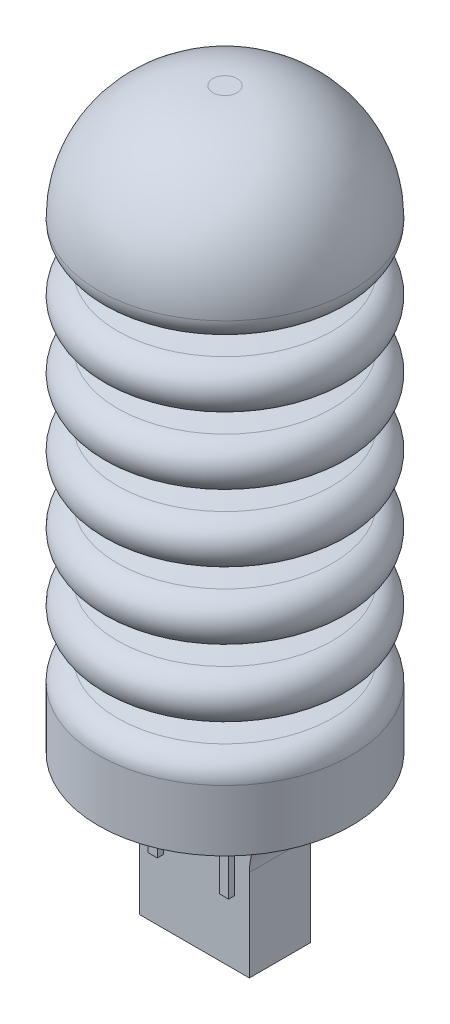
from build123d import *

# Parameters (mm, degrees)
BOSS_EXTRUDE2_REACH = 93.868
SKETCH2_R           = 20.750019809
BOSS_EXTRUDE1_DEPTH = 10
SKETCH5_R           = 2.05
CUT_EXTRUDE1_DEPTH  = 10
BOSS_EXTRUDE3_START = 25
SKETCH6_W           = 18
SKETCH6_H           = 10
SKETCH6_R           = 2.05
BOSS_EXTRUDE3_DEPTH = 25
FILLET1_R           = 10
SKETCH7_W           = 1.5
SKETCH7_H           = 14.5
BOSS_EXTRUDE4_DEPTH = 1


with BuildPart() as part:
    # Sketch1 → Revolve2 (revolve)
    with BuildSketch(Plane(origin=(0, 0, 0), x_dir=(0, 0, -1), z_dir=(1, 0, 0))):
        with BuildLine():
            Line((-9.616751909, 62.551085638), (-3.251663234, 61.489785283))
            ThreePointArc((-3.251663234, 61.489785283), (-2.625013615, 60.749995786), (-3.251668322, 60.010210599))
            Line((-3.251668322, 60.010210599), (-9.616767827, 58.948953436))
            ThreePointArc((-9.616767827, 58.948953436), (-12.75001785, 55.250030043), (-9.616764802, 51.551086511))
            Line((-9.616764802, 51.551086511), (-3.251664068, 50.489785422))
            ThreePointArc((-3.251664068, 50.489785422), (-2.625013615, 49.749996092), (-3.251668552, 49.010210561))
            Line((-3.251668552, 49.010210561), (-9.616745174, 47.948959247))
            ThreePointArc((-9.616745174, 47.948959247), (-12.750019856, 44.250032756), (-9.616769893, 40.551085326))
            Line((-9.616769893, 40.551085326), (-3.251664068, 39.489785422))
            ThreePointArc((-3.251664068, 39.489785422), (-2.625013615, 38.749996092), (-3.251668552, 38.010210561))
            Line((-3.251668552, 38.010210561), (-9.616745174, 36.948959247))
            ThreePointArc((-9.616745174, 36.948959247), (-12.750019856, 33.250032756), (-9.616769893, 29.551085326))
            Line((-9.616769893, 29.551085326), (-3.251663378, 28.489785307))
            ThreePointArc((-3.251663378, 28.489785307), (-2.625013615, 27.749995743), (-3.251668552, 27.010210561))
            Line((-3.251668552, 27.010210561), (-9.616745174, 25.948959247))
            ThreePointArc((-9.616745174, 25.948959247), (-12.750019856, 22.250032756), (-9.616769893, 18.551085326))
            Line((-9.616769893, 18.551085326), (-3.251663378, 17.489785307))
            ThreePointArc((-3.251663378, 17.489785307), (-2.625013615, 16.749995859), (-3.251668322, 16.010210599))
            Line((-3.251668322, 16.010210599), (-9.616745994, 14.948957076))
            ThreePointArc((-9.616745994, 14.948957076), (-12.75001785, 11.250032756), (-9.616770713, 7.551087497))
            Line((-9.616770713, 7.551087497), (-3.251663378, 6.489785307))
            ThreePointArc((-3.251663378, 6.489785307), (-2.625013615, 5.749995745), (-3.251668547, 5.010210562))
            Line((-3.251668547, 5.010210562), (-9.616754998, 3.948957561))
            ThreePointArc((-9.616754998, 3.948957561), (-11.861416619, 2.673841221), (-12.750019809, 0.250020225))
            Line((-12.750019809, 0.250020225), (-10.775764722, 0.250020225))
            ThreePointArc((-10.775764722, 0.250020225), (-10.351864543, 1.401447936), (-9.282548216, 2.003145308))
            Line((-9.282548216, 2.003145308), (-2.933588419, 3.035657967))
            ThreePointArc((-2.933588419, 3.035657967), (-0.625013615, 5.749989143), (-2.933570213, 8.464335802))
            Line((-2.933570213, 8.464335802), (-9.282554456, 9.496896148))
            ThreePointArc((-9.282554456, 9.496896148), (-10.775764722, 11.250020225), (-9.282554456, 13.003144302))
            Line((-9.282554456, 13.003144302), (-2.933588423, 14.035657967))
            ThreePointArc((-2.933588423, 14.035657967), (-0.625013615, 16.749989141), (-2.933570213, 19.464335802))
            Line((-2.933570213, 19.464335802), (-9.282554457, 20.496896149))
            ThreePointArc((-9.282554457, 20.496896149), (-10.775764722, 22.250020225), (-9.282554457, 24.003144302))
            Line((-9.282554457, 24.003144302), (-2.933588423, 25.035657967))
            ThreePointArc((-2.933588423, 25.035657967), (-0.625013615, 27.749989141), (-2.933570213, 30.464335802))
            Line((-2.933570213, 30.464335802), (-9.282554457, 31.496896149))
            ThreePointArc((-9.282554457, 31.496896149), (-10.775764722, 33.250020225), (-9.282554458, 35.003144302))
            Line((-9.282554458, 35.003144302), (-2.933588423, 36.035657967))
            ThreePointArc((-2.933588423, 36.035657967), (-0.625019121, 38.744495593), (-2.922729146, 41.46255044))
            Line((-2.922729146, 41.46255044), (-9.267799008, 42.414069793))
            ThreePointArc((-9.267799008, 42.414069793), (-10.855395735, 44.250136624), (-9.267568646, 46.086004242))
            Line((-9.267568646, 46.086004242), (-2.967353693, 47.030381961))
            ThreePointArc((-2.967353693, 47.030381961), (-0.625041747, 49.737559588), (-2.942767932, 52.465815677))
            Line((-2.942767932, 52.465815677), (-9.28255392, 53.474847144))
            ThreePointArc((-9.28255392, 53.474847144), (-10.797536189, 55.25002943), (-9.282548222, 57.025194214))
            Line((-9.282548222, 57.025194214), (-2.942786198, 58.034178147))
            ThreePointArc((-2.942786198, 58.034178147), (-0.625032387, 60.739837448), (-2.922728882, 63.462550396))
            Line((-2.922728882, 63.462550396), (-9.287817558, 64.523850751))
            ThreePointArc((-9.287817558, 64.523850751), (-10.335324829, 65.118911212), (-10.75, 66.250022585))
            ThreePointArc((-10.75, 66.250022585), (-5.8440306, 78.09404657), (6, 83))
            Line((6, 83), (8, 83))
            Line((8, 83), (8, 85))
            Line((8, 85), (6, 85))
            ThreePointArc((6, 85), (-7.258252147, 79.508252147), (-12.75, 66.25))
            ThreePointArc((-12.75, 66.25), (-11.86141141, 63.82621645), (-9.616751909, 62.551085638))
        make_face()
    revolve(axis=Axis((0, 83, -8), (0, -1, 0)))

    # Sketch4 → Boss-Extrude2 (add, up to next)
    with BuildSketch(Plane.XZ.offset(-0.250020225), mode=Mode.PRIVATE) as boss_extrude2_sk1:
        with BuildLine():
            Line((0.988565082, -28.726457999), (0.988565082, 12.726457999))
            ThreePointArc((0.988565082, 12.726457999), (0, 12.750019809), (-0.988565082, 12.726457999))
            Line((-0.988565082, 12.726457999), (-0.988565082, -28.726457999))
            ThreePointArc((-0.988565082, -28.726457999), (0, -28.750019809), (0.988565082, -28.726457999))
        make_face()
    boss_extrude2_tool1 = extrude(boss_extrude2_sk1.sketch, amount=-BOSS_EXTRUDE2_REACH, mode=Mode.PRIVATE) - part.part
    add(boss_extrude2_tool1.solids().sort_by_distance((0, 0.25002, -8))[0])

    # Sketch2 → Boss-Extrude1 (add)
    with BuildSketch(Plane.XZ.offset(-0.250020225)):
        with Locations(Location((0, -8, 0), (0, 0, 270))):
            Circle(SKETCH2_R)
    extrude(amount=BOSS_EXTRUDE1_DEPTH)

    # Sketch5 → Cut-Extrude1 (cut)
    with BuildSketch(Plane.XZ.offset(9.749979775)):
        with Locations(Location((-4, -8, 0), (0, 0, 270))):
            Circle(SKETCH5_R)
        with Locations(Location((4, -8, 0), (0, 0, 270))):
            Circle(SKETCH5_R)
    extrude(amount=-CUT_EXTRUDE1_DEPTH, mode=Mode.SUBTRACT)

    # Sketch6 → Boss-Extrude3 (add)
    with BuildSketch(Plane.XZ.offset(9.749979775).offset(BOSS_EXTRUDE3_START)):
        with Locations((0, -8)):
            Rectangle(SKETCH6_W, SKETCH6_H)
        with Locations(Location((-4, -8, 0), (0, 0, 270))):
            Circle(SKETCH6_R, mode=Mode.SUBTRACT)
        with Locations(Location((4, -8, 0), (0, 0, 270))):
            Circle(SKETCH6_R, mode=Mode.SUBTRACT)
    extrude(amount=-BOSS_EXTRUDE3_DEPTH)

    # Fillet1
    fillet1_edges = [part.edges().sort_by_distance(p)[0] for p in [
        (-9, -9.749979775, -8),
        (9, -9.749979775, -8),
    ]]
    fillet(fillet1_edges, radius=FILLET1_R)

    # Sketch7 → Boss-Extrude4 (add)
    with BuildSketch(Plane.XY.offset(-3)):
        with Locations((-5.85, -16.999979775)):
            Rectangle(SKETCH7_W, SKETCH7_H)
        with Locations((5.85, -16.999979775)):
            Rectangle(SKETCH7_W, SKETCH7_H)
    extrude(amount=BOSS_EXTRUDE4_DEPTH)


solid = part.part
